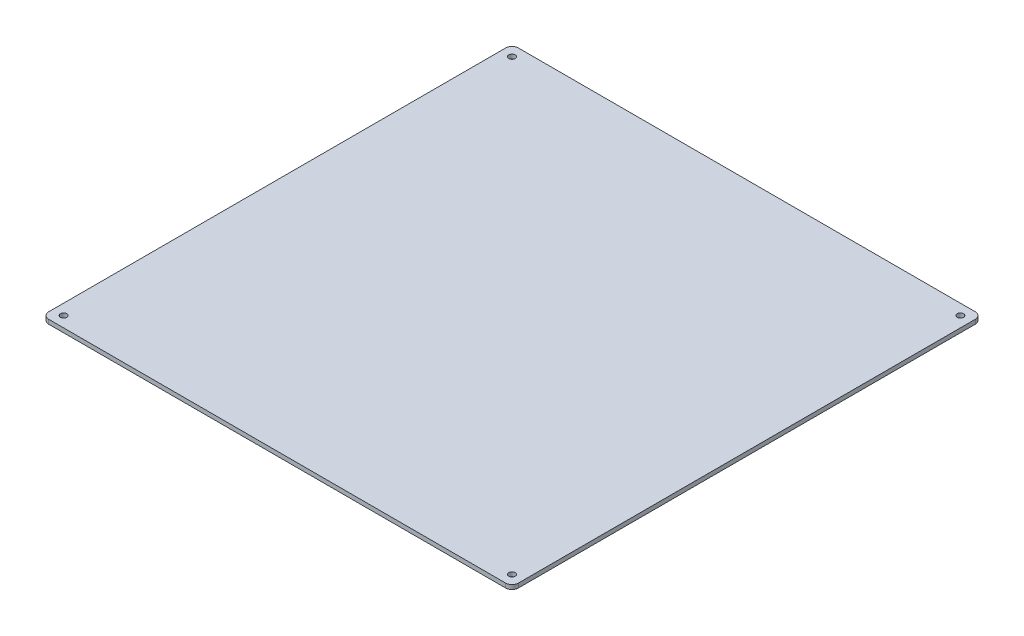
from build123d import *

# Parameters (mm, degrees)
SKETCH_1_W      = 219
SKETCH_1_H      = 219
SKETCH_1_R      = 1.5
EXTRUDE_1_DEPTH = 2
FILLET_1_R      = 3


with BuildPart() as part:
    # 스케치1 → 보스-돌출1 (new body)
    with BuildSketch(Plane(origin=(0, 0, 0), x_dir=(1, 0, 0), z_dir=(0, 1, 0))):
        Rectangle(SKETCH_1_W, SKETCH_1_H)
        with Locations(Location((-104.5, 104.5, 0), (0, 0, 270))):
            Circle(SKETCH_1_R, mode=Mode.SUBTRACT)
        with Locations(Location((-104.5, -104.5, 0), (0, 0, 90))):
            Circle(SKETCH_1_R, mode=Mode.SUBTRACT)
        with Locations(Location((104.5, -104.5, 0), (0, 0, 270))):
            Circle(SKETCH_1_R, mode=Mode.SUBTRACT)
        with Locations(Location((104.5, 104.5, 0), (0, 0, 90))):
            Circle(SKETCH_1_R, mode=Mode.SUBTRACT)
    extrude(amount=EXTRUDE_1_DEPTH)

    # 필렛1
    fillet_1_edges = [part.edges().sort_by_distance(p)[0] for p in [
        (109.5, 1, 109.5),
        (-109.5, 1, 109.5),
        (-109.5, 1, -109.5),
        (109.5, 1, -109.5),
    ]]
    fillet(fillet_1_edges, radius=FILLET_1_R)


solid = part.part
